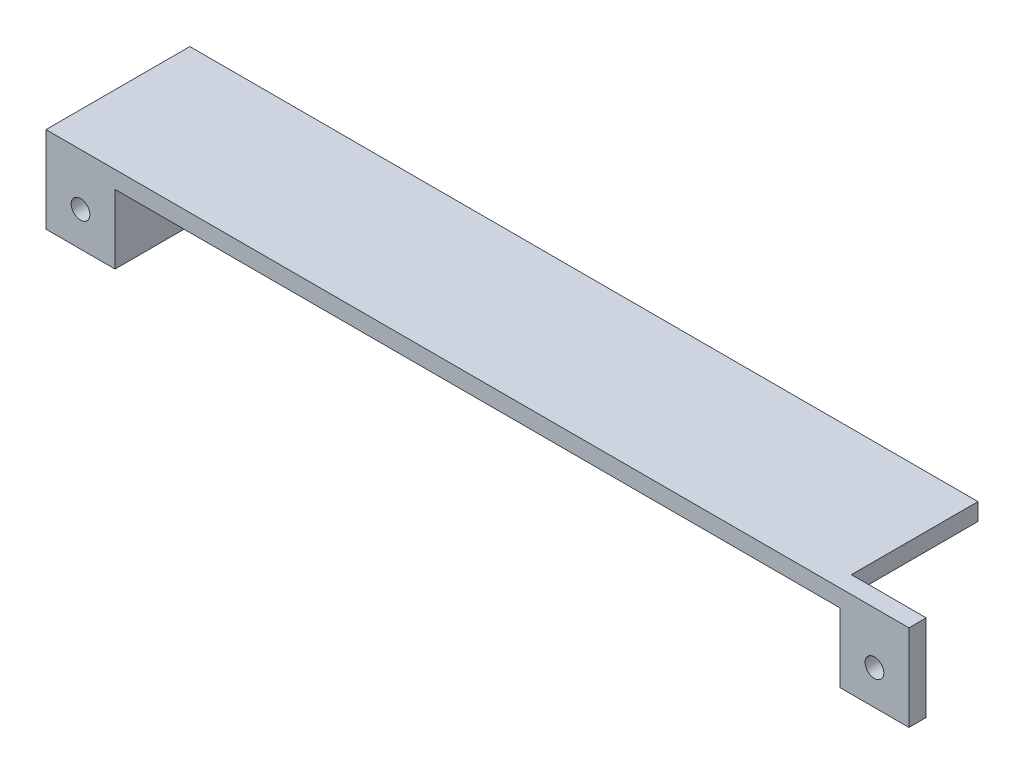
from build123d import *

# Parameters (mm, degrees)
SKETCH1_W           = 150
SKETCH1_H           = 25
BOSS_EXTRUDE1_DEPTH = 3
SKETCH2_W           = 12
SKETCH2_H           = 25
BOSS_EXTRUDE2_DEPTH = 12
SKETCH4_R           = 1.625
CUT_EXTRUDE1_DEPTH  = 153.541797551
SKETCH5_W           = 13
SKETCH5_H           = 22
CUT_EXTRUDE2_DEPTH  = 153.807067899


with BuildPart() as part:
    # Sketch1 → Boss-Extrude1 (new body)
    with BuildSketch(Plane(origin=(0, 0, 0), x_dir=(1, 0, 0), z_dir=(0, 1, 0))):
        with Locations((75, 12.5)):
            Rectangle(SKETCH1_W, SKETCH1_H)
    extrude(amount=BOSS_EXTRUDE1_DEPTH)

    # Sketch2 → Boss-Extrude2 (add)
    with BuildSketch(Plane.XZ):
        with Locations((6, -12.5)):
            Rectangle(SKETCH2_W, SKETCH2_H)
        with Locations((144, -12.5)):
            Rectangle(SKETCH2_W, SKETCH2_H)
    extrude(amount=BOSS_EXTRUDE2_DEPTH)

    # Sketch4 → Cut-Extrude1 (cut, through all)
    with BuildSketch(Plane.XY):
        with Locations((6, -6)):
            Circle(SKETCH4_R)
        with Locations(Location((144, -6, 0), (0, 0, 180))):
            Circle(SKETCH4_R)
    extrude(amount=-CUT_EXTRUDE1_DEPTH, mode=Mode.SUBTRACT)

    # Sketch5 → Cut-Extrude2 (cut, through all)
    with BuildSketch(Plane(origin=(0, 3, 0), x_dir=(1, 0, 0), z_dir=(0, 1, 0))):
        with Locations((143.5, 14)):
            Rectangle(SKETCH5_W, SKETCH5_H)
    extrude(amount=-CUT_EXTRUDE2_DEPTH, mode=Mode.SUBTRACT)


solid = part.part
